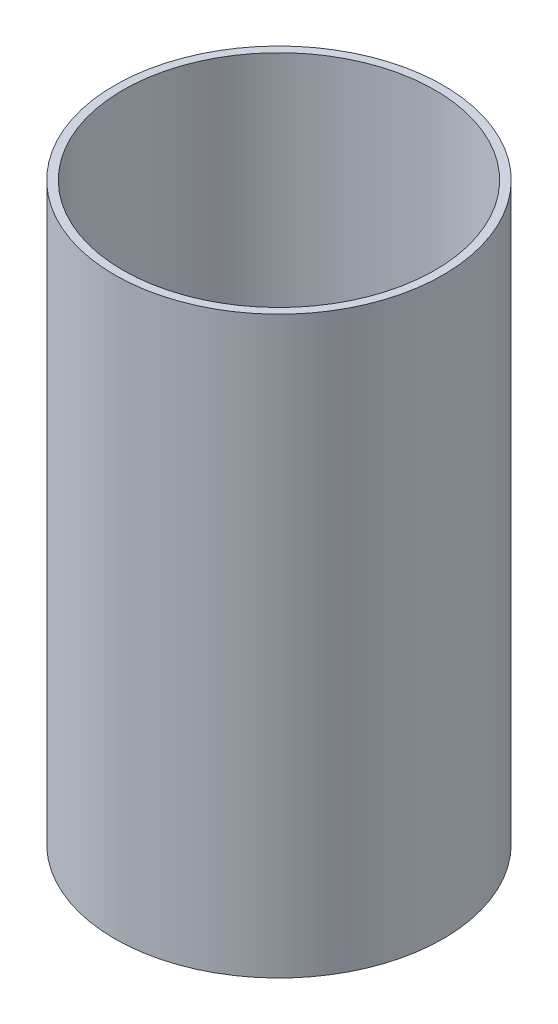
from build123d import *

# Parameters (mm, degrees)
SKETCH1_R           = 50.8
SKETCH1_R_2         = 48.26
BOSS_EXTRUDE1_DEPTH = 177.8


with BuildPart() as part:
    # Sketch1 → Boss-Extrude1 (new body)
    with BuildSketch(Plane(origin=(0, 0, 0), x_dir=(1, 0, 0), z_dir=(0, 1, 0))):
        with Locations(Location((0, 0, 0), (0, 0, 270))):
            Circle(SKETCH1_R)
        with Locations(Location((0, 0, 0), (0, 0, 270))):
            Circle(SKETCH1_R_2, mode=Mode.SUBTRACT)
    extrude(amount=BOSS_EXTRUDE1_DEPTH)


solid = part.part
